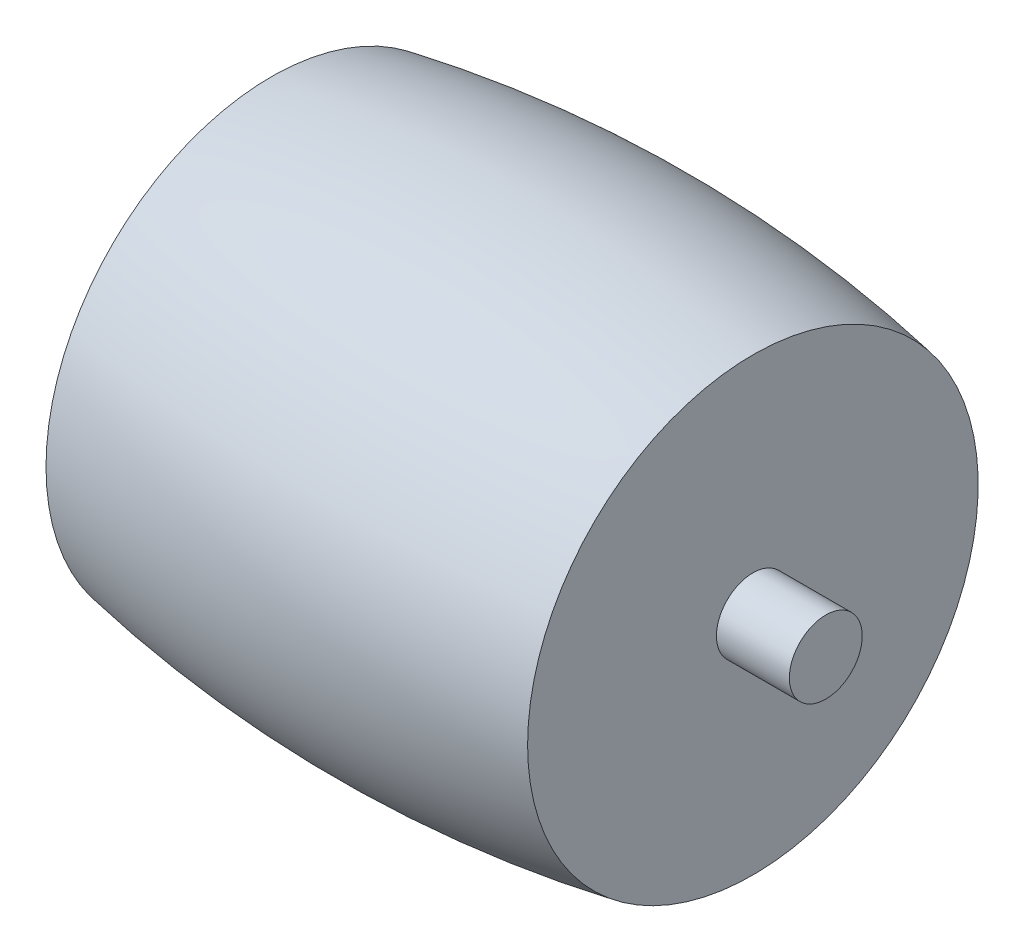
from build123d import *


with BuildPart() as part:
    # Sketch1 → Revolve1 (revolve)
    with BuildSketch(Plane.XY, mode=Mode.PRIVATE) as revolve1_sk:
        with BuildLine():
            Line((9.25, 50.154137417), (9.25, 42.9))
            Line((9.25, 42.9), (12.05, 42.9))
            Line((12.05, 42.9), (12.05, 41.5))
            Line((12.05, 41.5), (9.25, 41.5))
            Line((9.25, 41.5), (-9.25, 41.5))
            Line((-9.25, 41.5), (-12.05, 41.5))
            Line((-12.05, 41.5), (-12.05, 42.9))
            Line((-12.05, 42.9), (-9.25, 42.9))
            Line((-9.25, 42.9), (-9.25, 50.154137417))
            ThreePointArc((-9.25, 50.154137417), (0, 51), (9.25, 50.154137417))
        make_face()
    revolve(revolve1_sk.sketch.rotate(Axis((-9.25, 41.5, 0), (1, 0, 0)), 90), axis=Axis((-9.25, 41.5, 0), (1, 0, 0)))


solid = part.part
